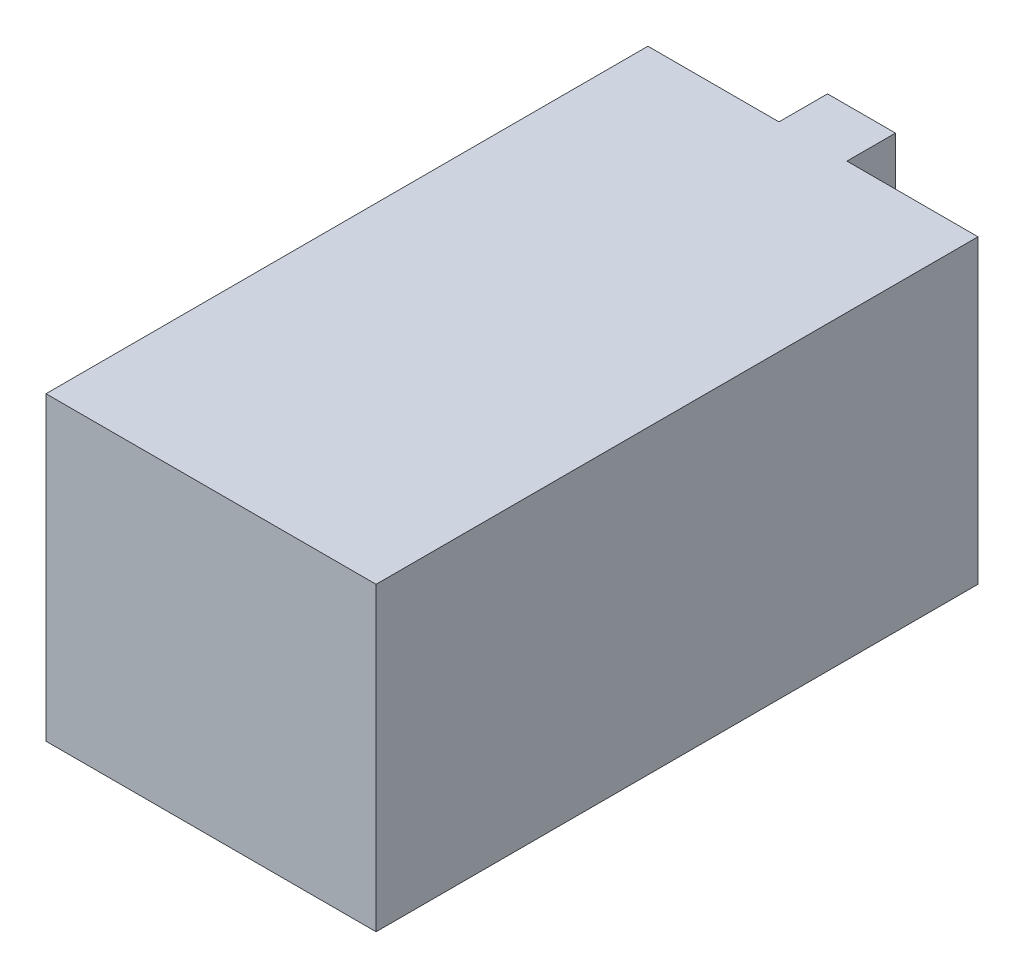
from build123d import *

# Parameters (mm, degrees)
SKETCH1_W           = 7
SKETCH1_H           = 5
BOSS_EXTRUDE1_DEPTH = 31


with BuildPart() as part:
    # Sketch1 → Boss-Extrude1 (new body)
    with BuildSketch(Plane(origin=(0, 0, 0), x_dir=(1, 0, 0), z_dir=(0, 1, 0))):
        with Locations((0, 28.5)):
            Rectangle(SKETCH1_W, SKETCH1_H)
        with Locations((0, 33.5)):
            Rectangle(SKETCH1_W, SKETCH1_H)
        Polygon((-3.5, 31), (-17, 31), (-17, -31), (17, -31), (17, 31), (3.5, 31), (3.5, 26), (-3.5, 26), align=None)
    extrude(amount=BOSS_EXTRUDE1_DEPTH)


solid = part.part
